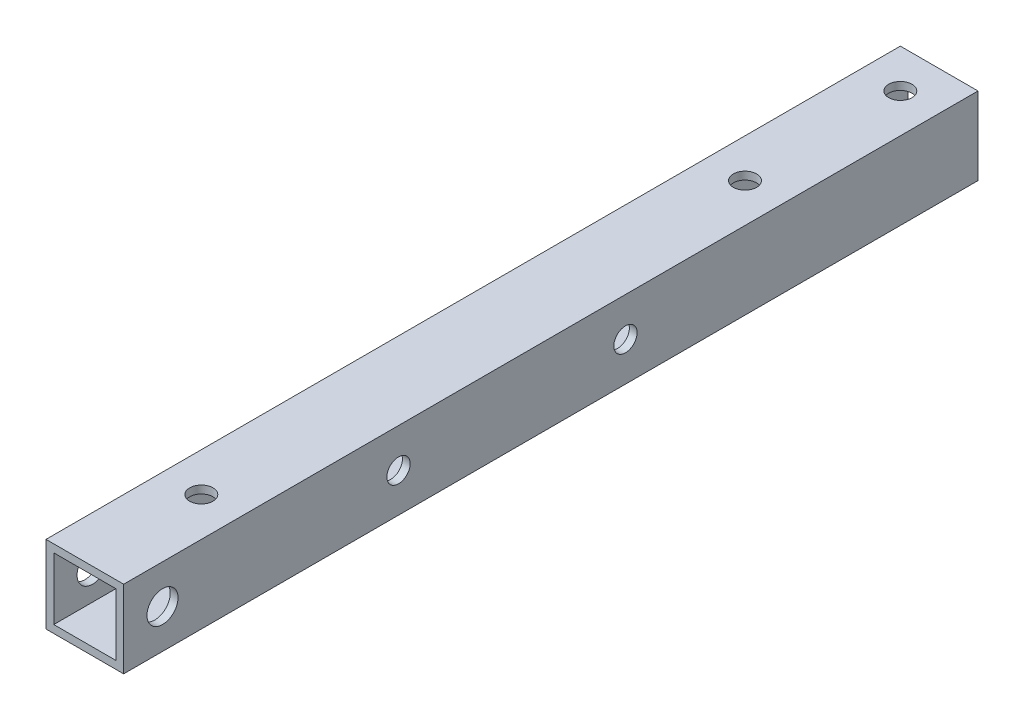
from build123d import *

# Parameters (mm, degrees)
SKETCH_1_W          = 10
SKETCH_1_H          = 10
SKETCH_1_W_2        = 8
SKETCH_1_H_2        = 8
EXTRUDE_1_DEPTH     = 100
SKETCH_3_R          = 1.5
CUT_EXTRUDE_2_DEPTH = 101.623058987
SKETCH_4_R          = 1.5
SKETCH_4_R_2        = 2
CUT_EXTRUDE_3_DEPTH = 101.623058987
SKETCH_5_W          = 10
SKETCH_5_H          = 10
SKETCH_5_W_2        = 8
SKETCH_5_H_2        = 8
EXTRUDE_2_DEPTH     = 10
SKETCH_6_R          = 1.5
CUT_EXTRUDE_4_DEPTH = 101.623058987


with BuildPart() as part:
    # ｽｹｯﾁ1 → 押し出し-薄板1 (new body)
    with BuildSketch(Plane.XY):
        Rectangle(SKETCH_1_W, SKETCH_1_H)
        Rectangle(SKETCH_1_W_2, SKETCH_1_H_2, mode=Mode.SUBTRACT)
    extrude(amount=EXTRUDE_1_DEPTH)

    # ｽｹｯﾁ3 → ｶｯﾄ - 押し出し2 (cut, through all)
    with BuildSketch(Plane.XZ.offset(5)):
        with Locations((0, 15)):
            Circle(SKETCH_3_R)
        with Locations((0, 85)):
            Circle(SKETCH_3_R)
    extrude(amount=-CUT_EXTRUDE_2_DEPTH, mode=Mode.SUBTRACT)

    # ｽｹｯﾁ4 → ｶｯﾄ - 押し出し3 (cut, through all)
    with BuildSketch(Plane(origin=(5, 0, 0), x_dir=(0, 0, -1), z_dir=(1, 0, 0))):
        with Locations((-64.61, 0)):
            Circle(SKETCH_4_R)
        with Locations(Location((-35.39, 0, 0), (0, 0, 180))):
            Circle(SKETCH_4_R)
        with Locations(Location((-95, 0, 0), (0, 0, 180))):
            Circle(SKETCH_4_R_2)
    extrude(amount=-CUT_EXTRUDE_3_DEPTH, mode=Mode.SUBTRACT)

    # ｽｹｯﾁ5 → 押し出し-薄板2 (add)
    with BuildSketch(Plane(origin=(0, 0, 0), x_dir=(-1, 0, 0), z_dir=(0, 0, -1))):
        Rectangle(SKETCH_5_W, SKETCH_5_H)
        Rectangle(SKETCH_5_W_2, SKETCH_5_H_2, mode=Mode.SUBTRACT)
    extrude(amount=EXTRUDE_2_DEPTH)

    # ｽｹｯﾁ6 → ｶｯﾄ - 押し出し4 (cut, through all)
    with BuildSketch(Plane(origin=(0, 5, 0), x_dir=(1, 0, 0), z_dir=(0, 1, 0))):
        with Locations(Location((0, 5, 0), (0, 0, 180))):
            Circle(SKETCH_6_R)
    extrude(amount=-CUT_EXTRUDE_4_DEPTH, mode=Mode.SUBTRACT)


solid = part.part
